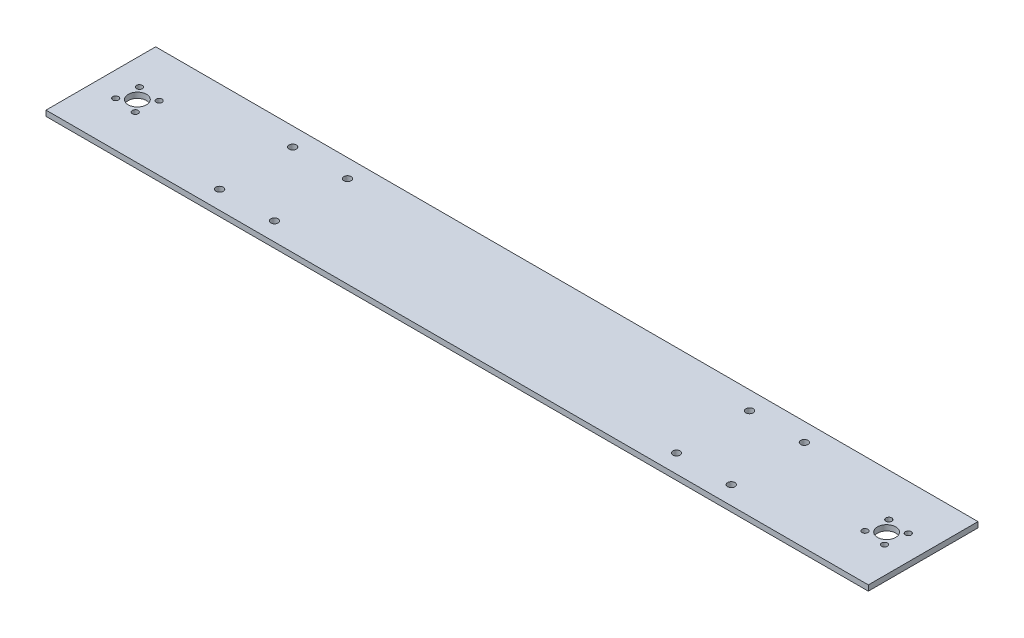
from build123d import *

# Parameters (mm, degrees)
SZKIC1_W                    = 450
SZKIC1_H                    = 60
DODANIE_WYCI_GNI_CIE1_DEPTH = 3
OTW_R_POD_RUB_M41_D         = 4
SZKIC8_R                    = 5
WYTNIJ_WYCI_GNI_CIE1_DEPTH  = 10
SZKIC9_R                    = 1.6
WYTNIJ_WYCI_GNI_CIE2_DEPTH  = 454.992290683
SZKIC10_R                   = 1.6
WYTNIJ_WYCI_GNI_CIE3_DEPTH  = 10


with BuildPart() as part:
    # Szkic1 → Dodanie-wyciągnięcie1 (new body)
    with BuildSketch(Plane(origin=(0, 0, 0), x_dir=(1, 0, 0), z_dir=(0, 1, 0))):
        with Locations((-225, 30)):
            Rectangle(SZKIC1_W, SZKIC1_H)
    extrude(amount=DODANIE_WYCI_GNI_CIE1_DEPTH)

    # Otwór pod śrubę M41 (through all)
    with Locations(Plane(origin=(0, 3, 0), x_dir=(1, 0, 0), z_dir=(0, 1, 0))):
        with Locations((-365, 50), (-335, 50), (-365, 10), (-335, 10), (-115, 50), (-85, 50), (-115, 10), (-85, 10)):
            Hole(OTW_R_POD_RUB_M41_D / 2)

    # Szkic8 → Wytnij-wyciągnięcie1 (cut)
    with BuildSketch(Plane(origin=(0, 3, 0), x_dir=(1, 0, 0), z_dir=(0, 1, 0))):
        with Locations(Location((-20, 30, 0), (0, 0, 270))):
            Circle(SZKIC8_R)
        with Locations(Location((-430, 30, 0), (0, 0, 270))):
            Circle(SZKIC8_R)
    extrude(amount=-WYTNIJ_WYCI_GNI_CIE1_DEPTH, mode=Mode.SUBTRACT)

    # Szkic9 → Wytnij-wyciągnięcie2 (cut, through all)
    with BuildSketch(Plane(origin=(0, 3, 0), x_dir=(1, 0, 0), z_dir=(0, 1, 0))):
        with Locations(Location((-435.356336542, 36.510917908, 0), (0, 0, 270))):
            Circle(SZKIC9_R)
        with Locations(Location((-436.510917908, 24.643663458, 0), (0, 0, 270))):
            Circle(SZKIC9_R)
        with Locations(Location((-424.643663458, 23.489082092, 0), (0, 0, 270))):
            Circle(SZKIC9_R)
        with Locations(Location((-423.489082092, 35.356336542, 0), (0, 0, 270))):
            Circle(SZKIC9_R)
    extrude(amount=-WYTNIJ_WYCI_GNI_CIE2_DEPTH, mode=Mode.SUBTRACT)

    # Szkic10 → Wytnij-wyciągnięcie3 (cut)
    with BuildSketch(Plane(origin=(0, 3, 0), x_dir=(1, 0, 0), z_dir=(0, 1, 0))):
        with Locations(Location((-13.489082092, 35.356336542, 0), (0, 0, 270))):
            Circle(SZKIC10_R)
        with Locations(Location((-14.643663458, 23.489082092, 0), (0, 0, 270))):
            Circle(SZKIC10_R)
        with Locations(Location((-26.510917908, 24.643663458, 0), (0, 0, 270))):
            Circle(SZKIC10_R)
        with Locations(Location((-25.345722644, 36.554977749, 0), (0, 0, 270))):
            Circle(SZKIC10_R)
    extrude(amount=-WYTNIJ_WYCI_GNI_CIE3_DEPTH, mode=Mode.SUBTRACT)


solid = part.part
